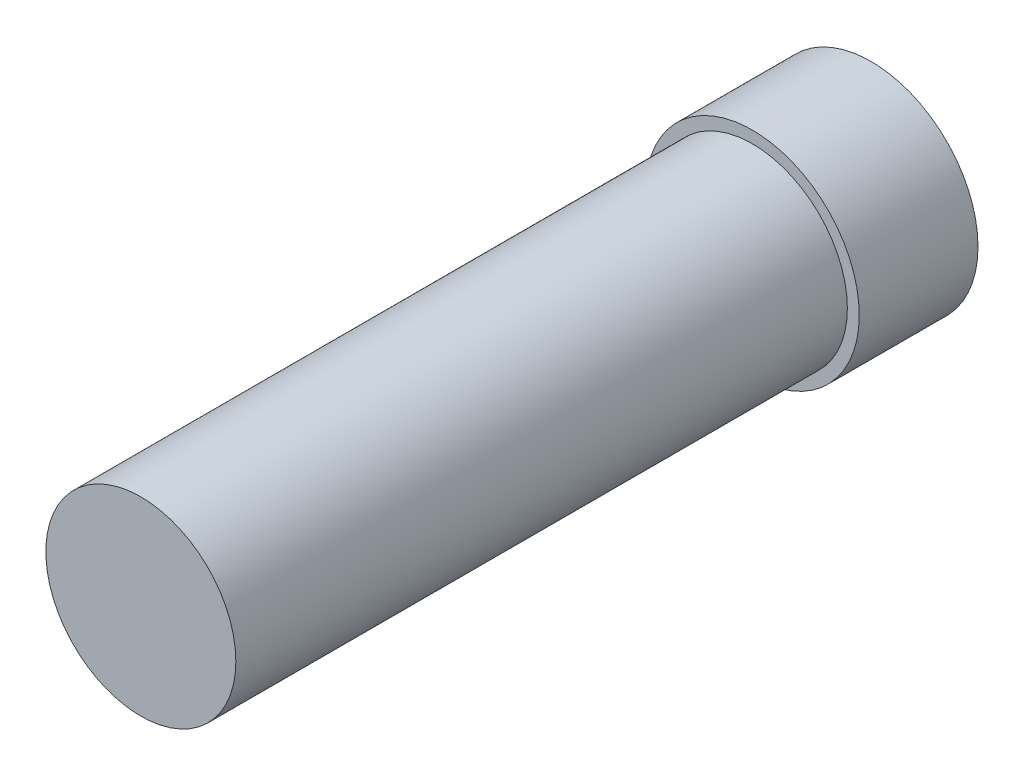
from build123d import *

# Parameters (mm, degrees)
SKETCH1_R           = 2.032
BOSS_EXTRUDE1_DEPTH = 13.08
SKETCH2_R           = 2.286
BOSS_EXTRUDE2_DEPTH = 2.54
CUT_EXTRUDE1_DEPTH  = 2.032


with BuildPart() as part:
    # Sketch1 → Boss-Extrude1 (new body)
    with BuildSketch(Plane.XY):
        Circle(SKETCH1_R)
    extrude(amount=BOSS_EXTRUDE1_DEPTH)

    # Sketch2 → Boss-Extrude2 (add)
    with BuildSketch(Plane(origin=(0, 0, 0), x_dir=(-1, 0, 0), z_dir=(0, 0, -1))):
        Circle(SKETCH2_R)
    extrude(amount=BOSS_EXTRUDE2_DEPTH)

    # Sketch3 → Cut-Extrude1 (cut)
    with BuildSketch(Plane(origin=(0, 0, -2.54), x_dir=(-1, 0, 0), z_dir=(0, 0, -1))):
        Polygon((0, -1.554742097), (1.346446152, -0.777371048), (1.346446152, 0.777371048), (0, 1.554742097), (-1.346446152, 0.777371048), (-1.346446152, -0.777371048), align=None)
    extrude(amount=-CUT_EXTRUDE1_DEPTH, mode=Mode.SUBTRACT)


solid = part.part
